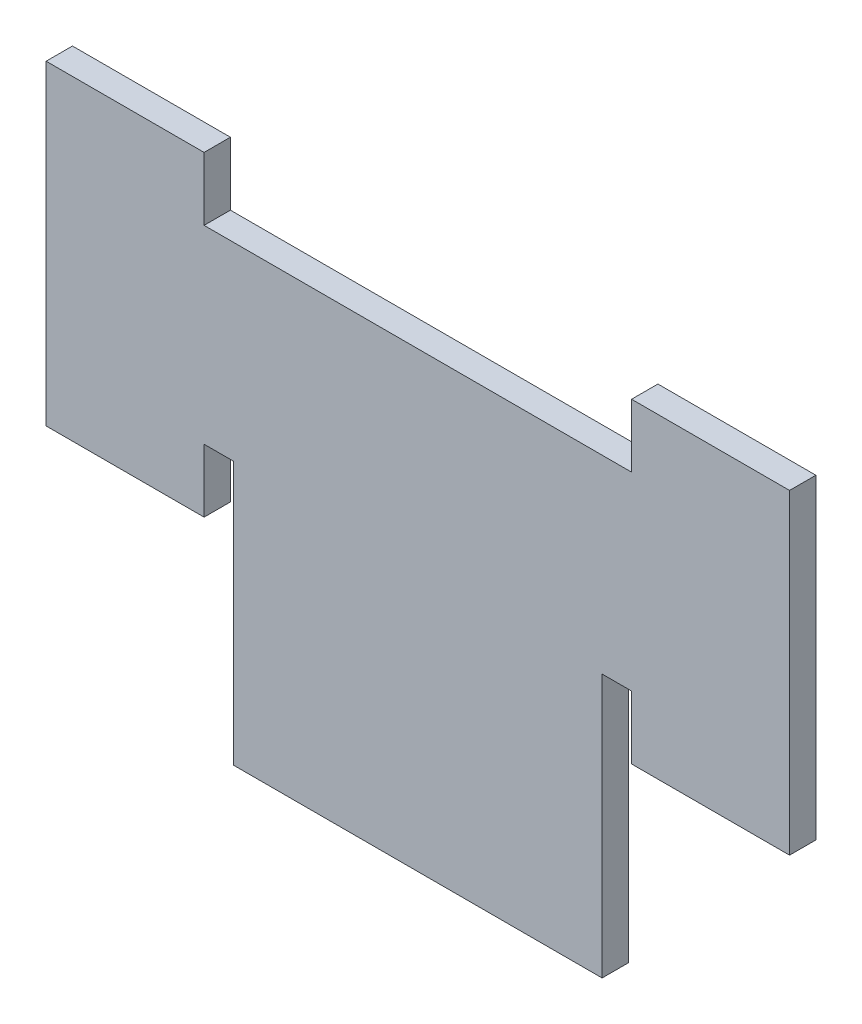
from build123d import *

# Parameters (mm, degrees)
BOSS_EXTRUDE1_DEPTH = 3.175


with BuildPart() as part:
    # Sketch1 → Boss-Extrude1 (new body)
    with BuildSketch(Plane.XY):
        Polygon((-3.556, 54.61), (48.006, 54.61), (48.006, 62.23), (67.056, 62.23), (67.056, 24.13), (48.006, 24.13), (48.006, 31.75), (44.45, 31.75), (44.45, 0), (0, 0), (0, 31.75), (-3.556, 31.75), (-3.556, 24.13), (-22.606, 24.13), (-22.606, 62.23), (-3.556, 62.23), align=None)
    extrude(amount=BOSS_EXTRUDE1_DEPTH)


solid = part.part
